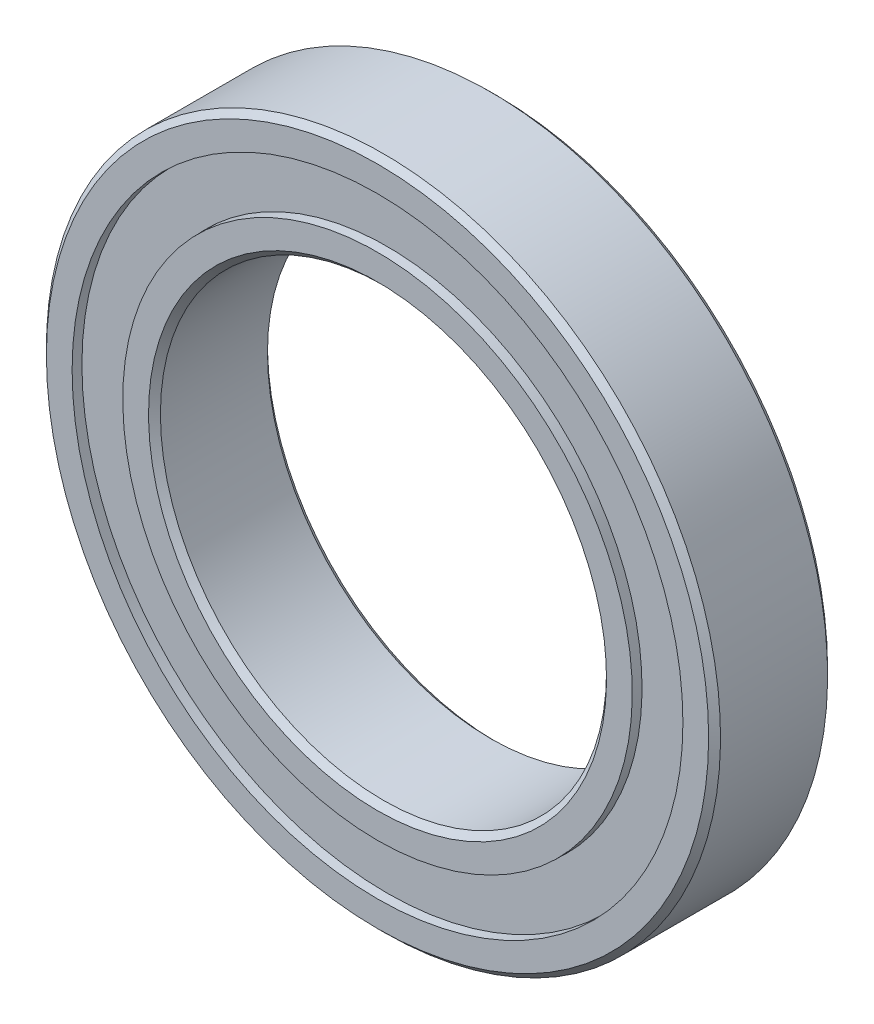
from build123d import *

# Parameters (mm, degrees)
SKETCH5_W         = 0.381
SKETCH5_H         = 5.060311112
CIRPATTERN1_COUNT = 15


with BuildPart() as part:
    # Sketch5 → Revolve1 (revolve)
    with BuildSketch(Plane(origin=(0, 0, 0), x_dir=(0, 0, -1), z_dir=(1, 0, 0)), mode=Mode.PRIVATE) as revolve1_sk:
        with BuildLine():
            Line((5.4, 34), (-5.4, 34))
            Line((-5.4, 34), (-6, 33.4))
            Line((-6, 33.4), (-6, 30.805555556))
            Line((-6, 30.805555556), (-2.666666667, 30.805555556))
            ThreePointArc((-2.666666667, 30.805555556), (0, 31.943504475), (2.666666667, 30.805555556))
            Line((2.666666667, 30.805555556), (6, 30.805555556))
            Line((6, 30.805555556), (6, 33.4))
            Line((6, 33.4), (5.4, 34))
        make_face()
        with Locations((4.846752238, 28.25)):
            Rectangle(SKETCH5_W, SKETCH5_H)
        with Locations((-4.846752238, 28.25)):
            Rectangle(SKETCH5_W, SKETCH5_H)
    revolve(revolve1_sk.sketch.rotate(Axis((0, 0, 6), (0, 0, -1)), 180), axis=Axis((0, 0, 6), (0, 0, -1)))


with BuildPart() as body_2:
    # Sketch3 → Revolve3 (revolve)
    with BuildSketch(Plane(origin=(0, 0, 0), x_dir=(0, 0, -1), z_dir=(1, 0, 0)), mode=Mode.PRIVATE) as revolve3_sk:
        with BuildLine():
            Line((-6, 25.694444444), (-2.666666667, 25.694444444))
            ThreePointArc((-2.666666667, 25.694444444), (0, 24.556495525), (2.666666667, 25.694444444))
            Line((2.666666667, 25.694444444), (6, 25.694444444))
            Line((6, 25.694444444), (6, 23.1))
            Line((6, 23.1), (5.4, 22.5))
            Line((5.4, 22.5), (-5.4, 22.5))
            Line((-5.4, 22.5), (-6, 23.1))
            Line((-6, 23.1), (-6, 25.694444444))
        make_face()
    revolve(revolve3_sk.sketch.rotate(Axis((0, 0, 6), (0, 0, -1)), 180), axis=Axis((0, 0, 6), (0, 0, -1)))


with BuildPart() as body_3:
    # Sketch4 → Revolve4 (revolve)
    with BuildSketch(Plane(origin=(0, 0, 0), x_dir=(0, 0, -1), z_dir=(1, 0, 0))):
        with BuildLine():
            Line((-3.693504475, 28.25), (3.693504475, 28.25))
            ThreePointArc((3.693504475, 28.25), (0, 31.943504475), (-3.693504475, 28.25))
        make_face()
    revolve(axis=Axis((0, 28.25, 3.693504475), (0, 0, -1)))


with BuildPart() as cirpattern1_1:
    # CirPattern1: pattern copy
    add(body_3.part.rotate(Axis((0, 0, 0), (0, 0, 1)), 1 * 360 / CIRPATTERN1_COUNT))


with BuildPart() as cirpattern1_2:
    # CirPattern1: pattern copy
    add(body_3.part.rotate(Axis((0, 0, 0), (0, 0, 1)), 2 * 360 / CIRPATTERN1_COUNT))


with BuildPart() as cirpattern1_3:
    # CirPattern1: pattern copy
    add(body_3.part.rotate(Axis((0, 0, 0), (0, 0, 1)), 3 * 360 / CIRPATTERN1_COUNT))


with BuildPart() as cirpattern1_4:
    # CirPattern1: pattern copy
    add(body_3.part.rotate(Axis((0, 0, 0), (0, 0, 1)), 4 * 360 / CIRPATTERN1_COUNT))


with BuildPart() as cirpattern1_5:
    # CirPattern1: pattern copy
    add(body_3.part.rotate(Axis((0, 0, 0), (0, 0, 1)), 5 * 360 / CIRPATTERN1_COUNT))


with BuildPart() as cirpattern1_6:
    # CirPattern1: pattern copy
    add(body_3.part.rotate(Axis((0, 0, 0), (0, 0, 1)), 6 * 360 / CIRPATTERN1_COUNT))


with BuildPart() as cirpattern1_7:
    # CirPattern1: pattern copy
    add(body_3.part.rotate(Axis((0, 0, 0), (0, 0, 1)), 7 * 360 / CIRPATTERN1_COUNT))


with BuildPart() as cirpattern1_8:
    # CirPattern1: pattern copy
    add(body_3.part.rotate(Axis((0, 0, 0), (0, 0, 1)), 8 * 360 / CIRPATTERN1_COUNT))


with BuildPart() as cirpattern1_9:
    # CirPattern1: pattern copy
    add(body_3.part.rotate(Axis((0, 0, 0), (0, 0, 1)), 9 * 360 / CIRPATTERN1_COUNT))


with BuildPart() as cirpattern1_10:
    # CirPattern1: pattern copy
    add(body_3.part.rotate(Axis((0, 0, 0), (0, 0, 1)), 10 * 360 / CIRPATTERN1_COUNT))


with BuildPart() as cirpattern1_11:
    # CirPattern1: pattern copy
    add(body_3.part.rotate(Axis((0, 0, 0), (0, 0, 1)), 11 * 360 / CIRPATTERN1_COUNT))


with BuildPart() as cirpattern1_12:
    # CirPattern1: pattern copy
    add(body_3.part.rotate(Axis((0, 0, 0), (0, 0, 1)), 12 * 360 / CIRPATTERN1_COUNT))


with BuildPart() as cirpattern1_13:
    # CirPattern1: pattern copy
    add(body_3.part.rotate(Axis((0, 0, 0), (0, 0, 1)), 13 * 360 / CIRPATTERN1_COUNT))


with BuildPart() as cirpattern1_14:
    # CirPattern1: pattern copy
    add(body_3.part.rotate(Axis((0, 0, 0), (0, 0, 1)), 14 * 360 / CIRPATTERN1_COUNT))


solid = Compound([part.part, body_2.part, body_3.part, cirpattern1_1.part, cirpattern1_2.part, cirpattern1_3.part, cirpattern1_4.part, cirpattern1_5.part, cirpattern1_6.part, cirpattern1_7.part, cirpattern1_8.part, cirpattern1_9.part, cirpattern1_10.part, cirpattern1_11.part, cirpattern1_12.part, cirpattern1_13.part, cirpattern1_14.part])
